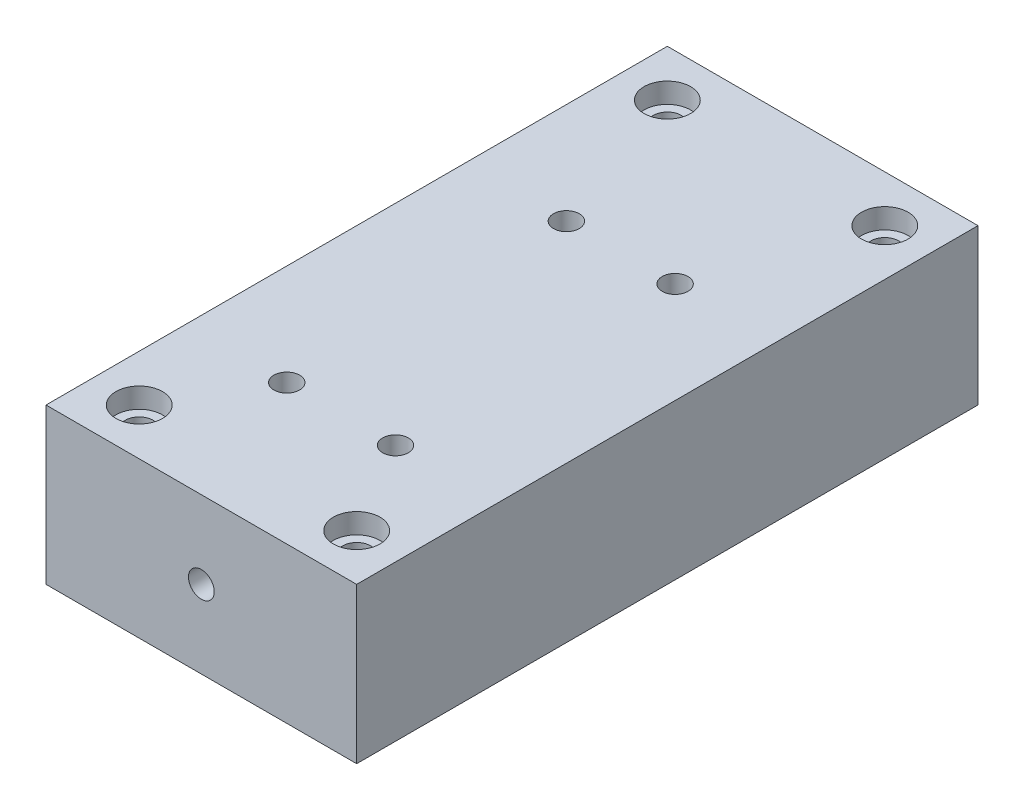
from build123d import *

# Parameters (mm, degrees)
SKIZZE1_W                                           = 100
SKIZZE1_H                                           = 50
AUFSATZ_LINEAR_AUSTRAGEN1_DEPTH                     = 200
STIRNSENKUNG_F_R_M8_SENKSCHRAUBE_KOPF_B_D           = 9
STIRNSENKUNG_F_R_M8_SENKSCHRAUBE_KOPF_B_CBORE_D     = 15
STIRNSENKUNG_F_R_M8_SENKSCHRAUBE_KOPF_B_CBORE_DEPTH = 6.5
SPIEGELN3_COPY_1_D                                  = 9
SPIEGELN3_COPY_1_CBORE_D                            = 15
SPIEGELN3_COPY_1_CBORE_DEPTH                        = 6.5
KERNLOCH_F_R_M8_HELICOIL0_D                         = 8.3
KERNLOCH_F_R_M8_HELICOIL0_DEPTH                     = 20
KERNLOCH_F_R_M8_HELICOIL0_TIP                       = 2.493571569
KERNLOCH_F_R_M8_HELICOIL0_2_D                       = 8.3
KERNLOCH_F_R_M8_HELICOIL0_2_DEPTH                   = 20
KERNLOCH_F_R_M8_HELICOIL0_2_TIP                     = 2.493571569
KERNLOCH_F_R_M8_HELICOIL3_D                         = 8.3
KERNLOCH_F_R_M8_HELICOIL3_DEPTH                     = 20
KERNLOCH_F_R_M8_HELICOIL3_TIP                       = 2.493571569
KERNLOCH_F_R_M8_HELICOIL4_D                         = 8.3
KERNLOCH_F_R_M8_HELICOIL4_DEPTH                     = 20
KERNLOCH_F_R_M8_HELICOIL4_TIP                       = 2.493571569


with BuildPart() as part:
    # Skizze1 → Aufsatz-Linear austragen1 (new body)
    with BuildSketch(Plane.XY):
        Rectangle(SKIZZE1_W, SKIZZE1_H)
    extrude(amount=AUFSATZ_LINEAR_AUSTRAGEN1_DEPTH)

    # Stirnsenkung für M8 Senkschraube (Kopf Button)4 (through all)
    with Locations(Plane(origin=(0, 25, 0), x_dir=(1, 0, 0), z_dir=(0, 1, 0))):
        with Locations((-35, -185)):
            stirnsenkung_f_r_m8_senkschraube_kopf_b = CounterBoreHole(STIRNSENKUNG_F_R_M8_SENKSCHRAUBE_KOPF_B_D / 2, STIRNSENKUNG_F_R_M8_SENKSCHRAUBE_KOPF_B_CBORE_D / 2, STIRNSENKUNG_F_R_M8_SENKSCHRAUBE_KOPF_B_CBORE_DEPTH)

    # Spiegeln2: Stirnsenkung für M8 Senkschraube (Kopf Button)4 across plane
    add(stirnsenkung_f_r_m8_senkschraube_kopf_b.mirror(Plane(origin=(0, 0, 0), x_dir=(0, 0, 1), z_dir=(1, 0, 0))), mode=Mode.SUBTRACT)

    # Spiegeln3: Stirnsenkung für M8 Senkschraube (Kopf Button)4 across plane
    add(stirnsenkung_f_r_m8_senkschraube_kopf_b.mirror(Plane.XY.offset(100)), mode=Mode.SUBTRACT)

    # Spiegeln3 copy 1 (through all)
    with Locations(Plane(origin=(0, 25, 200), x_dir=(-1, 0, 0), z_dir=(0, 1, 0))):
        with Locations((-35, -185)):
            CounterBoreHole(SPIEGELN3_COPY_1_D / 2, SPIEGELN3_COPY_1_CBORE_D / 2, SPIEGELN3_COPY_1_CBORE_DEPTH)

    # Kernloch f_r M8 Helicoil0
    with Locations(Plane.ZY.offset(50)):
        with Locations((35, -7.5)):
            Hole(KERNLOCH_F_R_M8_HELICOIL0_D / 2, depth=KERNLOCH_F_R_M8_HELICOIL0_DEPTH)
            with Locations((0, 0, -(KERNLOCH_F_R_M8_HELICOIL0_DEPTH + KERNLOCH_F_R_M8_HELICOIL0_TIP / 2))):  # 118° drill point
                Cone(0, KERNLOCH_F_R_M8_HELICOIL0_D / 2, KERNLOCH_F_R_M8_HELICOIL0_TIP, mode=Mode.SUBTRACT)

    # Kernloch f_r M8 Helicoil0 2
    with Locations(Plane.ZY.offset(50)):
        with Locations((165, -7.5)):
            Hole(KERNLOCH_F_R_M8_HELICOIL0_2_D / 2, depth=KERNLOCH_F_R_M8_HELICOIL0_2_DEPTH)
            with Locations((0, 0, -(KERNLOCH_F_R_M8_HELICOIL0_2_DEPTH + KERNLOCH_F_R_M8_HELICOIL0_2_TIP / 2))):  # 118° drill point
                Cone(0, KERNLOCH_F_R_M8_HELICOIL0_2_D / 2, KERNLOCH_F_R_M8_HELICOIL0_2_TIP, mode=Mode.SUBTRACT)

    # Kernloch für M8 Helicoil3
    with Locations(Plane.XY.offset(200)):
        with Locations((0, 0)):
            Hole(KERNLOCH_F_R_M8_HELICOIL3_D / 2, depth=KERNLOCH_F_R_M8_HELICOIL3_DEPTH)
            with Locations((0, 0, -(KERNLOCH_F_R_M8_HELICOIL3_DEPTH + KERNLOCH_F_R_M8_HELICOIL3_TIP / 2))):  # 118° drill point
                Cone(0, KERNLOCH_F_R_M8_HELICOIL3_D / 2, KERNLOCH_F_R_M8_HELICOIL3_TIP, mode=Mode.SUBTRACT)

    # Kernloch für M8 Helicoil4
    with Locations(Plane(origin=(0, 25, 0), x_dir=(1, 0, 0), z_dir=(0, 1, 0))):
        with Locations((-17.5, -65), (17.5, -65), (17.5, -155), (-17.5, -155)):
            Hole(KERNLOCH_F_R_M8_HELICOIL4_D / 2, depth=KERNLOCH_F_R_M8_HELICOIL4_DEPTH)
            with Locations((0, 0, -(KERNLOCH_F_R_M8_HELICOIL4_DEPTH + KERNLOCH_F_R_M8_HELICOIL4_TIP / 2))):  # 118° drill point
                Cone(0, KERNLOCH_F_R_M8_HELICOIL4_D / 2, KERNLOCH_F_R_M8_HELICOIL4_TIP, mode=Mode.SUBTRACT)


solid = part.part
